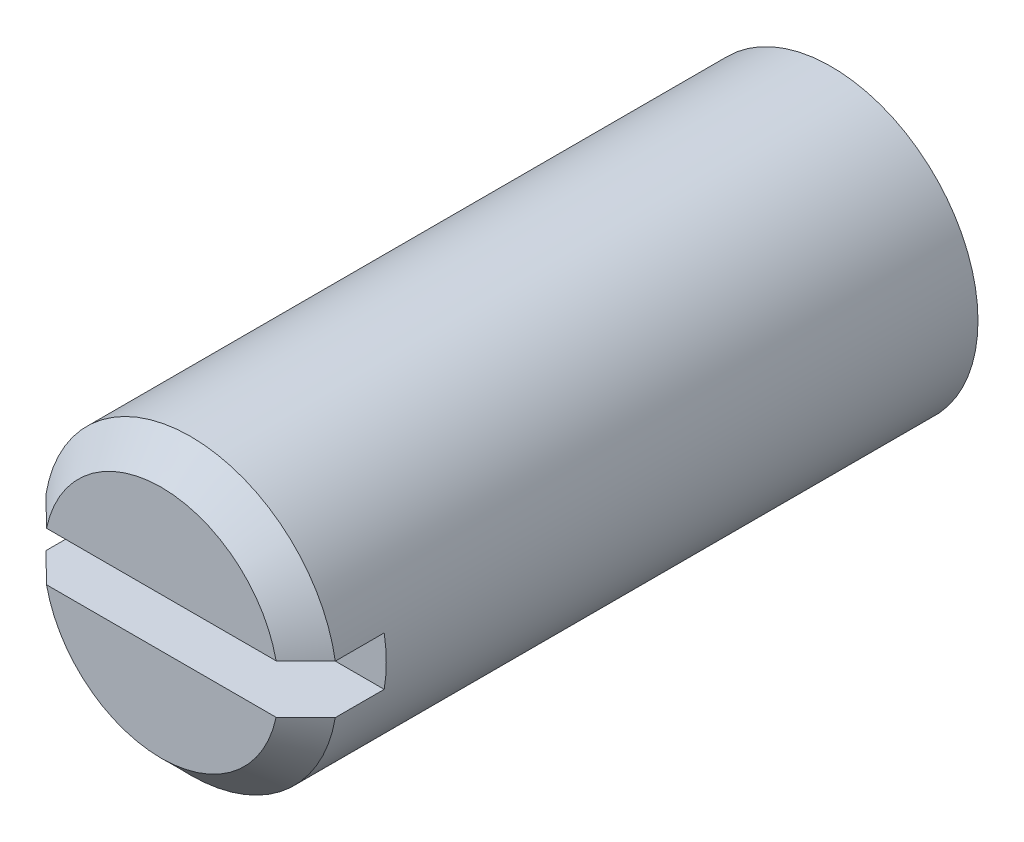
from build123d import *

# Parameters (mm, degrees)
CUT_EXTRUDE_1_DEPTH      = 16.588457268
CUT_EXTRUDE_1_DEPTH_BACK = 16.588457268
SKETCH_2_W               = 1.6
SKETCH_2_H               = 1
CHAMFER_1_SIZE           = 0.6


with BuildPart() as part:
    # Эскиз1 → Повернуть1 (revolve)
    with BuildSketch(Plane(origin=(0, 0, 0), x_dir=(1, 0, 0), z_dir=(0, 1, 0))):
        Polygon((0, 0), (-3, 0), (-3, 13.700961894), (-0.75, 15), (0, 15), align=None)
    revolve(axis=Axis((0, 0, -15), (0, 0, 1)))

    # Эскиз2 → Вырез-Вытянуть1 (cut, two sides: drawn at the far end of the back side and taken through both)
    with BuildSketch(Plane(origin=(0, 0, 0), x_dir=(0, 0, -1), z_dir=(1, 0, 0)).offset(-CUT_EXTRUDE_1_DEPTH_BACK)):
        with Locations((0.8, 0)):
            Rectangle(SKETCH_2_W, SKETCH_2_H)
    extrude(amount=CUT_EXTRUDE_1_DEPTH + CUT_EXTRUDE_1_DEPTH_BACK, mode=Mode.SUBTRACT)

    # Фаска1
    chamfer_1_edges = [part.edges().sort_by_distance(p)[0] for p in [
        (0, 3, 0),
        (0, -3, 0),
    ]]
    chamfer(chamfer_1_edges, length=CHAMFER_1_SIZE)


solid = part.part
